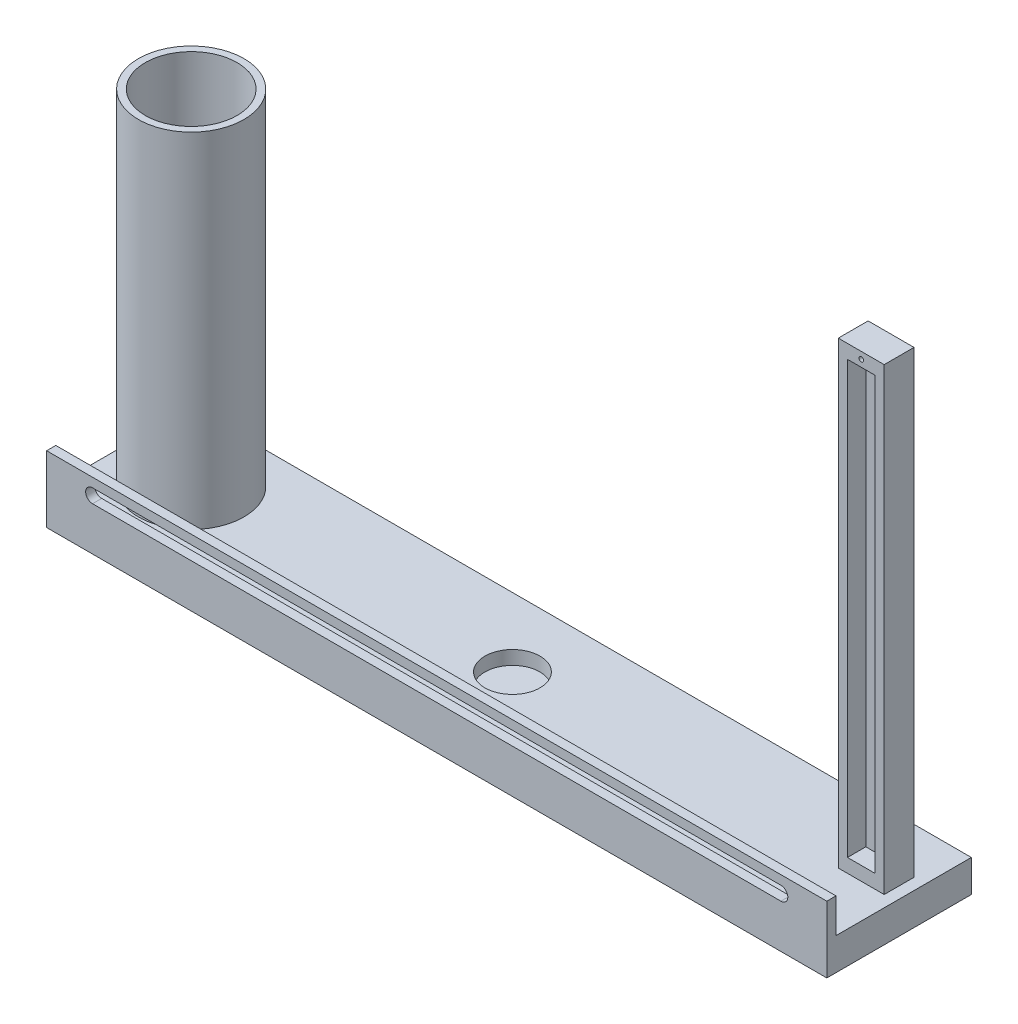
from build123d import *

# Parameters (mm, degrees)
SKETCH1_W                      = 170
SKETCH1_H                      = 31.5
BOSS_EXTRUDE1_DEPTH            = 14.5
SKETCH2_W                      = 29.500000008
SKETCH2_H                      = 7.499999998
CUT_EXTRUDE1_DEPTH             = 174.50072046
CUT_EXTRUDE2_DEPTH             = 174.50072046
SKETCH4_W                      = 10.000000025
SKETCH4_H                      = 6.5
BOSS_EXTRUDE2_DEPTH            = 100
SKETCH5_W                      = 6
SKETCH5_H                      = 94
CUT_EXTRUDE3_DEPTH             = 4
SKETCH6_W                      = 11.5
SKETCH6_H                      = 75
F_12_0_12_DIAMETER_HOLE1_D     = 12
F_12_0_12_DIAMETER_HOLE1_DEPTH = 3
F_1_0_1_DIAMETER_HOLE1_D       = 1
F_1_0_1_DIAMETER_HOLE1_DEPTH   = 1
F_20_0_20_DIAMETER_HOLE1_D     = 20
F_20_0_20_DIAMETER_HOLE1_DEPTH = 79


with BuildPart() as part:
    # Sketch1 → Boss-Extrude1 (new body)
    with BuildSketch(Plane.XZ):
        with Locations((85, -15.75)):
            Rectangle(SKETCH1_W, SKETCH1_H)
    extrude(amount=-BOSS_EXTRUDE1_DEPTH)

    # Sketch2 → Cut-Extrude1 (cut, through all)
    with BuildSketch(Plane(origin=(170, 0, 0), x_dir=(0, 0, -1), z_dir=(1, 0, 0))):
        with Locations((16.749999996, 10.750000001)):
            Rectangle(SKETCH2_W, SKETCH2_H)
    extrude(amount=-CUT_EXTRUDE1_DEPTH, mode=Mode.SUBTRACT)

    # Sketch3 → Cut-Extrude2 (cut, through all)
    with BuildSketch(Plane.XY):
        with BuildLine():
            Line((160, 12.5), (10, 12.5))
            ThreePointArc((10, 12.5), (8.500000001, 11.000000001), (10, 9.500000002))
            Line((10, 9.500000002), (160, 9.500000002))
            ThreePointArc((160, 9.500000002), (161.499999999, 11.000000001), (160, 12.5))
        make_face()
    extrude(amount=-CUT_EXTRUDE2_DEPTH, mode=Mode.SUBTRACT)

    # Sketch4 → Boss-Extrude2 (add)
    with BuildSketch(Plane(origin=(0, 7.000000002, 0), x_dir=(-1, 0, 0), z_dir=(0, 1, 0))):
        with Locations((-162.500000003, -18.249999999)):
            Rectangle(SKETCH4_W, SKETCH4_H)
    extrude(amount=BOSS_EXTRUDE2_DEPTH)

    # Sketch5 → Cut-Extrude3 (cut)
    with BuildSketch(Plane.XY.offset(-14.999999999)):
        with Locations((162.5, 57)):
            Rectangle(SKETCH5_W, SKETCH5_H)
    extrude(amount=-CUT_EXTRUDE3_DEPTH, mode=Mode.SUBTRACT)

    # Sketch6 → Revolve1 (revolve)
    with BuildSketch(Plane.XY.offset(-16.5), mode=Mode.PRIVATE) as revolve1_sk:
        with Locations((20.75, 44.5)):
            Rectangle(SKETCH6_W, SKETCH6_H)
    revolve(revolve1_sk.sketch.rotate(Axis((15, 82, -16.5), (0, -1, 0)), 270), axis=Axis((15, 82, -16.5), (0, -1, 0)))

    # Ø12.0 (12) Diameter Hole1
    with Locations(Plane(origin=(0, 7.000000002, 0), x_dir=(1, 0, 0), z_dir=(0, 1, 0))):
        with Locations((85, 16.5)):
            Hole(F_12_0_12_DIAMETER_HOLE1_D / 2, depth=F_12_0_12_DIAMETER_HOLE1_DEPTH)

    # Ø1.0 (1) Diameter Hole1
    with Locations(Plane.XY.offset(-14.999999999)):
        with Locations((162.5, 105.5)):
            Hole(F_1_0_1_DIAMETER_HOLE1_D / 2, depth=F_1_0_1_DIAMETER_HOLE1_DEPTH)

    # Ø20.0 (20) Diameter Hole1
    with Locations(Plane(origin=(0, 82, 0), x_dir=(1, 0, 0), z_dir=(0, 1, 0))):
        with Locations((15, 16.5)):
            Hole(F_20_0_20_DIAMETER_HOLE1_D / 2, depth=F_20_0_20_DIAMETER_HOLE1_DEPTH)


solid = part.part
